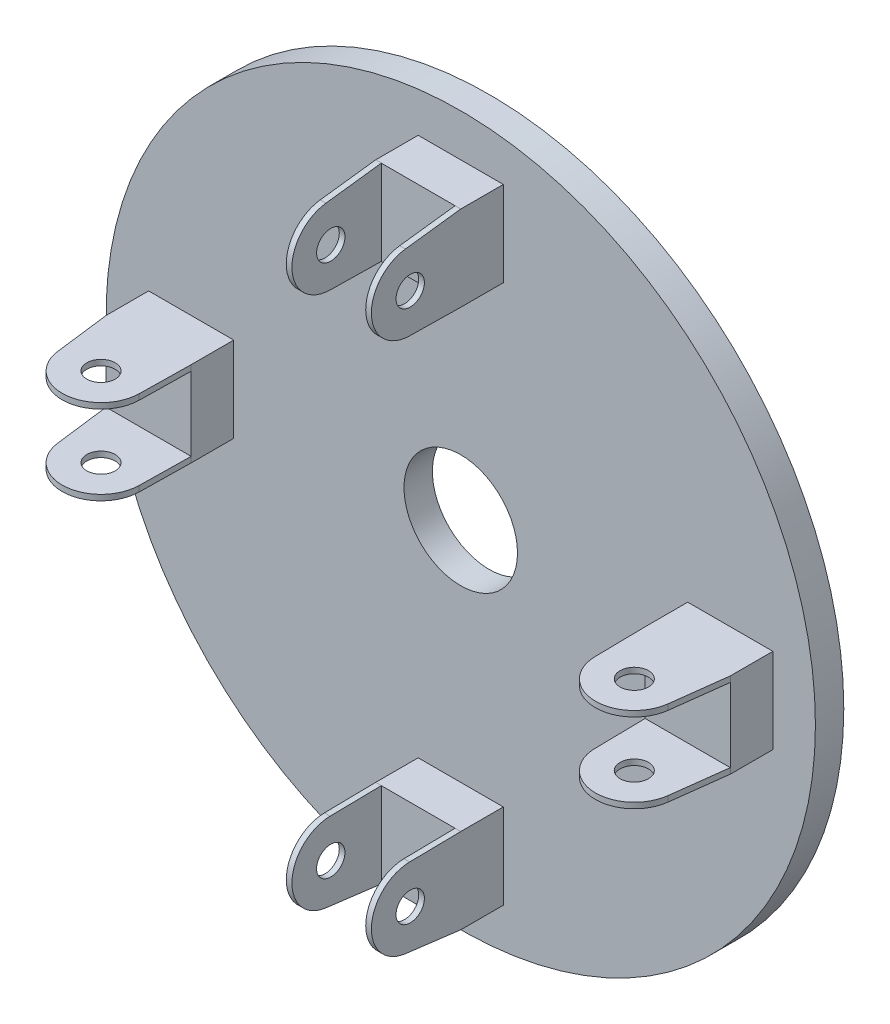
from build123d import *

# Parameters (mm, degrees)
SKETCH_1_R               = 125
SKETCH_1_W               = 30
SKETCH_1_H               = 30
SKETCH_1_R_2             = 20
EXTRUDE_1_DEPTH          = 10
SKETCH_1_3_W             = 30
SKETCH_1_3_H             = 30
EXTRUDE_2_DEPTH          = 25
SKETCH_7_R               = 5
EXTRUDE_3_DEPTH          = 2
EXTRUDE_START            = -2
SKETCH_4_R               = 5
EXTRUDE_4_DEPTH          = 2
PATTERN_CIRCULAR_1_COUNT = 4


with BuildPart() as part:
    # 草图1 → 凸台-拉伸1 (new body)
    with BuildSketch(Plane.XY):
        Circle(SKETCH_1_R)
        with Locations((0, -95)):
            Rectangle(SKETCH_1_W, SKETCH_1_H, mode=Mode.SUBTRACT)
        Circle(SKETCH_1_R_2, mode=Mode.SUBTRACT)
        with Locations((95, 0)):
            Rectangle(SKETCH_1_W, SKETCH_1_H, mode=Mode.SUBTRACT)
        with Locations((-95, 0)):
            Rectangle(SKETCH_1_W, SKETCH_1_H, mode=Mode.SUBTRACT)
        with Locations((0, 95)):
            Rectangle(SKETCH_1_W, SKETCH_1_H, mode=Mode.SUBTRACT)
    extrude(amount=EXTRUDE_1_DEPTH)

    # 草图1<3> → 凸台-拉伸2 (add)
    with BuildSketch(Plane.XY):
        with Locations((-95, 0)):
            Rectangle(SKETCH_1_3_W, SKETCH_1_3_H)
        with Locations((0, 95)):
            Rectangle(SKETCH_1_3_W, SKETCH_1_3_H)
        with Locations((0, -95)):
            Rectangle(SKETCH_1_3_W, SKETCH_1_3_H)
        with Locations((95, 0)):
            Rectangle(SKETCH_1_3_W, SKETCH_1_3_H)
    extrude(amount=EXTRUDE_2_DEPTH)

    # 草图7 → 凸台-拉伸3 (add)
    with BuildSketch(Plane(origin=(0, 15, 0), x_dir=(1, 0, 0), z_dir=(0, 1, 0))):
        with BuildLine():
            ThreePointArc((80.290043894, -43.026337076), (93.228538873, -56.470313397), (107.550432268, -44.510860179))
            Line((107.550432268, -44.510860179), (110, -25))
            Line((110, -25), (80, -25))
            Line((80, -25), (80.290043894, -43.026337076))
        make_face()
        with Locations((93.972648447, -42.80618387)):
            Circle(SKETCH_7_R, mode=Mode.SUBTRACT)
    extrude_3 = extrude(amount=-EXTRUDE_3_DEPTH)

    # 草图4 → 凸台-拉伸4 (add)
    with BuildSketch(Plane.XZ.offset(15).offset(EXTRUDE_START)):
        with BuildLine():
            Line((110, 25), (107.550432268, 44.510860179))
            ThreePointArc((107.550432268, 44.510860179), (93.228538873, 56.470313397), (80.290043894, 43.026337076))
            Line((80.290043894, 43.026337076), (80, 25))
            Line((80, 25), (110, 25))
        make_face()
        with Locations((93.972648447, 42.80618387)):
            Circle(SKETCH_4_R, mode=Mode.SUBTRACT)
    extrude_4 = extrude(amount=EXTRUDE_4_DEPTH)

    # 阵列(圆周)1: 凸台-拉伸3, 凸台-拉伸4 ×4 about axis
    pattern_circular_1_axis = Axis((0, 0, 10), (0, 0, 1))
    add([extrude_3.rotate(pattern_circular_1_axis, i * 360 / PATTERN_CIRCULAR_1_COUNT) for i in range(1, PATTERN_CIRCULAR_1_COUNT)])
    add([extrude_4.rotate(pattern_circular_1_axis, i * 360 / PATTERN_CIRCULAR_1_COUNT) for i in range(1, PATTERN_CIRCULAR_1_COUNT)])


solid = part.part
